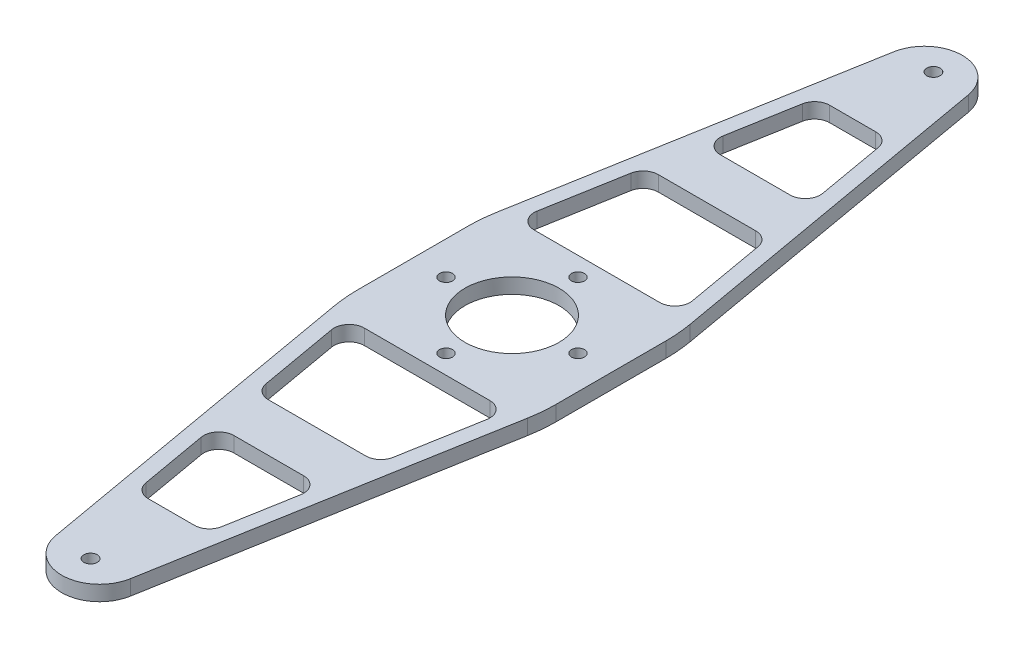
from build123d import *

# Parameters (mm, degrees)
BOSS_EXTRUDE1_DEPTH     = 5
CUT_EXTRUDE1_DEPTH      = 153.164632892
CUT_EXTRUDE1_DEPTH_BACK = 153.164632892
SKETCH2_R               = 15.5
SKETCH2_R_2             = 2.15
CUT_EXTRUDE2_DEPTH      = 153.164632892
CUT_EXTRUDE2_DEPTH_BACK = 153.164632892
SKETCH3_R               = 2.2


with BuildPart() as part:
    # Sketch1 → Boss-Extrude1 (new body)
    with BuildSketch(Plane(origin=(0, 0, 0), x_dir=(1, 0, 0), z_dir=(0, 1, 0))):
        with BuildLine():
            Line((-12.310096913, 138.193763743), (-31.950416611, 26.807975707))
            ThreePointArc((-31.950416611, 26.807975707), (-32.519763865, 22.483353961), (-32.71002896, 18.125566824))
            Line((-32.71002896, 18.125566824), (-32.71002896, -18.125566824))
            ThreePointArc((-32.71002896, -18.125566824), (-32.519763865, -22.483353961), (-31.950416611, -26.807975707))
            Line((-31.950416611, -26.807975707), (-12.310096913, -138.193763743))
            ThreePointArc((-12.310096913, -138.193763743), (0, -148.523161522), (12.310096913, -138.193763743))
            Line((12.310096913, -138.193763743), (31.950416611, -26.807975707))
            ThreePointArc((31.950416611, -26.807975707), (32.519763865, -22.483353961), (32.71002896, -18.125566824))
            Line((32.71002896, -18.125566824), (32.71002896, 18.125566824))
            ThreePointArc((32.71002896, 18.125566824), (32.519763865, 22.483353961), (31.950416611, 26.807975707))
            Line((31.950416611, 26.807975707), (12.310096913, 138.193763743))
            ThreePointArc((12.310096913, 138.193763743), (0, 148.523161522), (-12.310096913, 138.193763743))
        make_face()
        with BuildLine():
            Line((12.512772117, 108.250483124), (16.422284735, 86.078535291))
            ThreePointArc((16.422284735, 86.078535291), (15.328468186, 81.996356354), (11.49824597, 80.210294402))
            Line((11.49824597, 80.210294402), (-11.49824597, 80.210294402))
            ThreePointArc((-11.49824597, 80.210294402), (-15.328468186, 81.996356354), (-16.422284735, 86.078535291))
            Line((-16.422284735, 86.078535291), (-12.512772117, 108.250483124))
            ThreePointArc((-12.512772117, 108.250483124), (-10.802671401, 111.212464452), (-7.588733352, 112.382242236))
            Line((-7.588733352, 112.382242236), (7.588733352, 112.382242236))
            ThreePointArc((7.588733352, 112.382242236), (10.802671401, 111.212464452), (12.512772117, 108.250483124))
        make_face(mode=Mode.SUBTRACT)
        with BuildLine():
            Line((-16.065250357, 64.309525453), (16.065250357, 64.309525453))
            ThreePointArc((16.065250357, 64.309525453), (19.279188405, 63.139747668), (20.989289122, 60.177766341))
            Line((20.989289122, 60.177766341), (25.626657813, 33.877941591))
            ThreePointArc((25.626657813, 33.877941591), (24.532841264, 29.795762655), (20.702619048, 28.009700703))
            Line((20.702619048, 28.009700703), (-20.702619048, 28.009700703))
            ThreePointArc((-20.702619048, 28.009700703), (-24.532841264, 29.795762655), (-25.626657813, 33.877941591))
            Line((-25.626657813, 33.877941591), (-20.989289122, 60.177766341))
            ThreePointArc((-20.989289122, 60.177766341), (-19.279188405, 63.139747668), (-16.065250357, 64.309525453))
        make_face(mode=Mode.SUBTRACT)
        with BuildLine():
            Line((-7.588733352, -112.382242236), (7.588733352, -112.382242236))
            ThreePointArc((7.588733352, -112.382242236), (10.802671401, -111.212464452), (12.512772117, -108.250483124))
            Line((12.512772117, -108.250483124), (16.422284735, -86.078535291))
            ThreePointArc((16.422284735, -86.078535291), (15.328468186, -81.996356354), (11.49824597, -80.210294402))
            Line((11.49824597, -80.210294402), (-11.49824597, -80.210294402))
            ThreePointArc((-11.49824597, -80.210294402), (-15.328468186, -81.996356354), (-16.422284735, -86.078535291))
            Line((-16.422284735, -86.078535291), (-12.512772117, -108.250483124))
            ThreePointArc((-12.512772117, -108.250483124), (-10.802671401, -111.212464452), (-7.588733352, -112.382242236))
        make_face(mode=Mode.SUBTRACT)
        with BuildLine():
            Line((-20.989289122, -60.177766341), (-25.626657813, -33.877941591))
            ThreePointArc((-25.626657813, -33.877941591), (-24.532841264, -29.795762655), (-20.702619048, -28.009700703))
            Line((-20.702619048, -28.009700703), (20.702619048, -28.009700703))
            ThreePointArc((20.702619048, -28.009700703), (24.532841264, -29.795762655), (25.626657813, -33.877941591))
            Line((25.626657813, -33.877941591), (20.989289122, -60.177766341))
            ThreePointArc((20.989289122, -60.177766341), (19.279188405, -63.139747668), (16.065250357, -64.309525453))
            Line((16.065250357, -64.309525453), (-16.065250357, -64.309525453))
            ThreePointArc((-16.065250357, -64.309525453), (-19.279188405, -63.139747668), (-20.989289122, -60.177766341))
        make_face(mode=Mode.SUBTRACT)
    extrude(amount=BOSS_EXTRUDE1_DEPTH)

    # Sketch2 → Cut-Extrude1 (cut, two sides: drawn at the far end of the back side and taken through both)
    with BuildSketch(Plane(origin=(0, 5, 0), x_dir=(1, 0, 0), z_dir=(0, 1, 0)).offset(-CUT_EXTRUDE1_DEPTH_BACK)):
        with Locations(Location((0, 0, 0), (0, 0, 270))):
            Circle(SKETCH2_R)
        with Locations(Location((0, 21.754850352, 0), (0, 0, 270))):
            Circle(SKETCH2_R_2)
        with Locations(Location((21.754850352, 0, 0), (0, 0, 270))):
            Circle(SKETCH2_R_2)
        with Locations(Location((0, -21.754850352, 0), (0, 0, 270))):
            Circle(SKETCH2_R_2)
        with Locations(Location((-21.754850352, 0, 0), (0, 0, 270))):
            Circle(SKETCH2_R_2)
    extrude(amount=CUT_EXTRUDE1_DEPTH + CUT_EXTRUDE1_DEPTH_BACK, mode=Mode.SUBTRACT)

    # Sketch3 → Cut-Extrude2 (cut, two sides: drawn at the far end of the back side and taken through both)
    with BuildSketch(Plane.XZ.offset(-CUT_EXTRUDE2_DEPTH_BACK)):
        with Locations(Location((0, -139, 0), (0, 0, 270))):
            Circle(SKETCH3_R)
        with Locations(Location((0, 139, 0), (0, 0, 270))):
            Circle(SKETCH3_R)
    extrude(amount=CUT_EXTRUDE2_DEPTH + CUT_EXTRUDE2_DEPTH_BACK, mode=Mode.SUBTRACT)


solid = part.part
